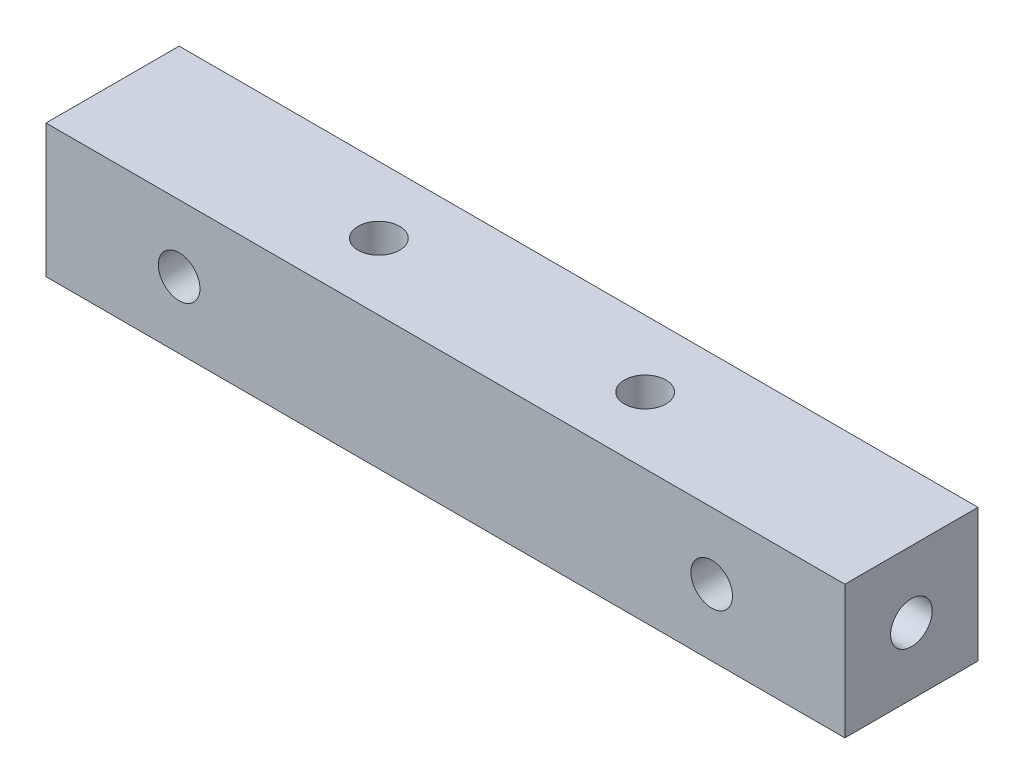
from build123d import *

# Parameters (mm, degrees)
SKETCH_1_W             = 48
SKETCH_1_H             = 8
EXTRUDE_1_DEPTH        = 8
HOLE_WIZARD_M3_1_D     = 2.5
HOLE_WIZARD_M3_1_DEPTH = 18.5
HOLE_WIZARD_M3_1_TIP   = 0.751075774
HOLE_WIZARD_M3_2_D     = 2.5
HOLE_WIZARD_M3_2_DEPTH = 18.5
HOLE_WIZARD_M3_2_TIP   = 0.751075774
HOLE_WIZARD_M3_3_D     = 2.5
HOLE_WIZARD_M3_3_DEPTH = 58.5
HOLE_WIZARD_M3_3_TIP   = 0.751075774


with BuildPart() as part:
    # 草图1 → 凸台-拉伸1 (new body)
    with BuildSketch(Plane.XY):
        Rectangle(SKETCH_1_W, SKETCH_1_H)
    extrude(amount=EXTRUDE_1_DEPTH)

    # M3 螺纹孔1
    with Locations(Plane.XY.offset(8)):
        with Locations((-16, 0), (16, 0)):
            Hole(HOLE_WIZARD_M3_1_D / 2, depth=HOLE_WIZARD_M3_1_DEPTH)
            with Locations((0, 0, -(HOLE_WIZARD_M3_1_DEPTH + HOLE_WIZARD_M3_1_TIP / 2))):  # 118° drill point
                Cone(0, HOLE_WIZARD_M3_1_D / 2, HOLE_WIZARD_M3_1_TIP, mode=Mode.SUBTRACT)

    # M3 螺纹孔2
    with Locations(Plane(origin=(0, 4, 0), x_dir=(1, 0, 0), z_dir=(0, 1, 0))):
        with Locations((-8, -4), (8, -4)):
            Hole(HOLE_WIZARD_M3_2_D / 2, depth=HOLE_WIZARD_M3_2_DEPTH)
            with Locations((0, 0, -(HOLE_WIZARD_M3_2_DEPTH + HOLE_WIZARD_M3_2_TIP / 2))):  # 118° drill point
                Cone(0, HOLE_WIZARD_M3_2_D / 2, HOLE_WIZARD_M3_2_TIP, mode=Mode.SUBTRACT)

    # M3 螺纹孔3
    with Locations(Plane.ZY.offset(24)):
        with Locations((4, 0)):
            Hole(HOLE_WIZARD_M3_3_D / 2, depth=HOLE_WIZARD_M3_3_DEPTH)
            with Locations((0, 0, -(HOLE_WIZARD_M3_3_DEPTH + HOLE_WIZARD_M3_3_TIP / 2))):  # 118° drill point
                Cone(0, HOLE_WIZARD_M3_3_D / 2, HOLE_WIZARD_M3_3_TIP, mode=Mode.SUBTRACT)


solid = part.part
